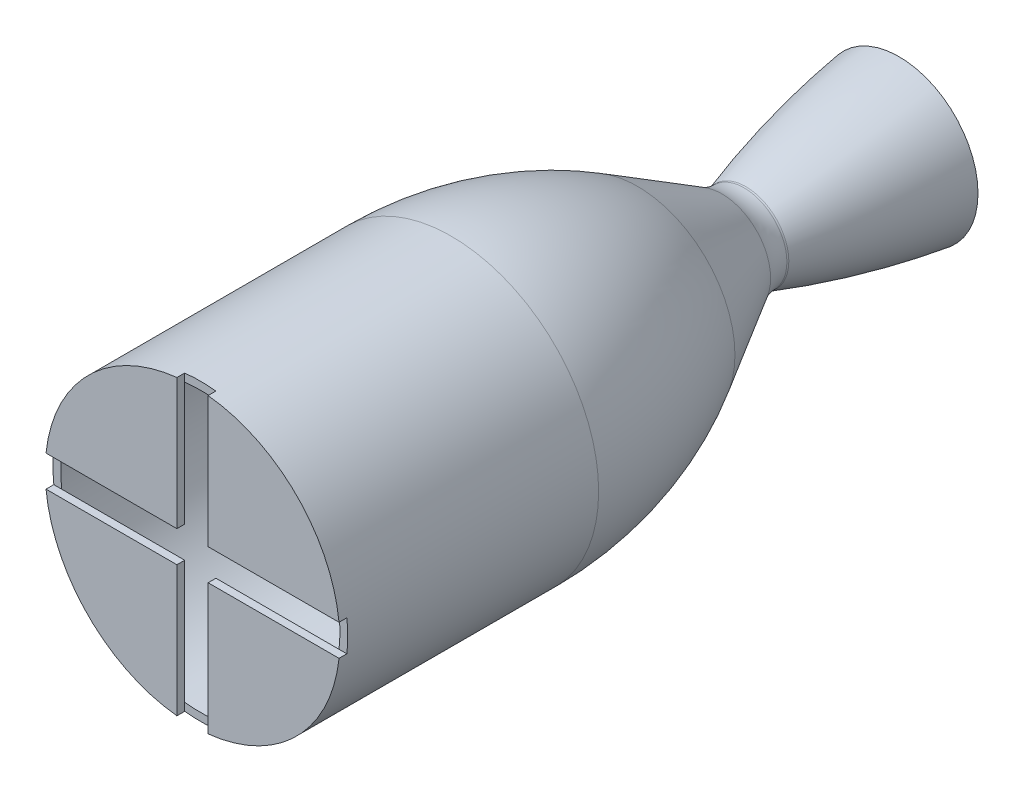
from build123d import *

# Parameters (mm, degrees)
SKETCH4_W          = 3.175
SKETCH4_H          = 12.7
CUT_EXTRUDE1_DEPTH = 298.085874974
CIRPATTERN1_COUNT  = 2
CIRPATTERN1_ANGLE  = 90


with BuildPart() as part:
    # Sketch2 → Revolve-Thin4 (revolve)
    with BuildSketch(Plane(origin=(0, 0, 0), x_dir=(0, 0, -1), z_dir=(1, 0, 0)), mode=Mode.PRIVATE) as revolve_thin4_sk:
        with BuildLine():
            Line((0, 0), (0, 56.769))
            Line((0, 56.769), (102.108, 56.769))
            ThreePointArc((102.108, 56.769), (140.500181874, 51.714573368), (176.276, 36.895744296))
            Line((176.276, 36.895744296), (210.593607924, 17.082464123))
            ThreePointArc((210.593607924, 17.082464123), (215.726112327, 14.954565751), (221.234, 14.224))
            ThreePointArc((221.234, 14.224), (222.082948, 14.290879198), (222.910433569, 14.49200893))
            ThreePointArc((222.910433569, 14.49200893), (253.5018987, 23.093142917), (284.734, 28.956))
            Line((284.734, 28.956), (284.286874616, 32.099358696))
            ThreePointArc((284.286874616, 32.099358696), (252.778619357, 26.184662284), (221.916664766, 17.507477147))
            ThreePointArc((221.916664766, 17.507477147), (221.581730132, 17.426067494), (221.238108322, 17.398997342))
            ThreePointArc((221.238108322, 17.398997342), (216.549846791, 18.020847951), (212.181107924, 19.83209478))
            Line((212.181107924, 19.83209478), (177.8635, 39.645374953))
            ThreePointArc((177.8635, 39.645374953), (141.321932343, 54.781387867), (102.108, 59.944))
            Line((102.108, 59.944), (-3.175, 59.944))
            Line((-3.175, 59.944), (-3.175, 0))
            Line((-3.175, 0), (0, 0))
        make_face()
    revolve(revolve_thin4_sk.sketch.rotate(Axis((0, 0, 0), (0, 0, -1)), 90), axis=Axis((0, 0, 0), (0, 0, -1)))

    # Sketch4 → Cut-Extrude1 (cut, symmetric)
    with BuildSketch(Plane(origin=(0, 0, 0), x_dir=(0, 0, -1), z_dir=(1, 0, 0))):
        with Locations((-1.5875, 0)):
            Rectangle(SKETCH4_W, SKETCH4_H)
    cut_extrude1 = extrude(amount=CUT_EXTRUDE1_DEPTH, both=True, mode=Mode.SUBTRACT)

    # CirPattern1: Cut-Extrude1 ×2 about axis
    cirpattern1_axis = Axis((0, 0, 3.175), (0, 0, 1))
    for i in range(1, CIRPATTERN1_COUNT):
        add(cut_extrude1.rotate(cirpattern1_axis, i * CIRPATTERN1_ANGLE / (CIRPATTERN1_COUNT - 1)), mode=Mode.SUBTRACT)


solid = part.part
